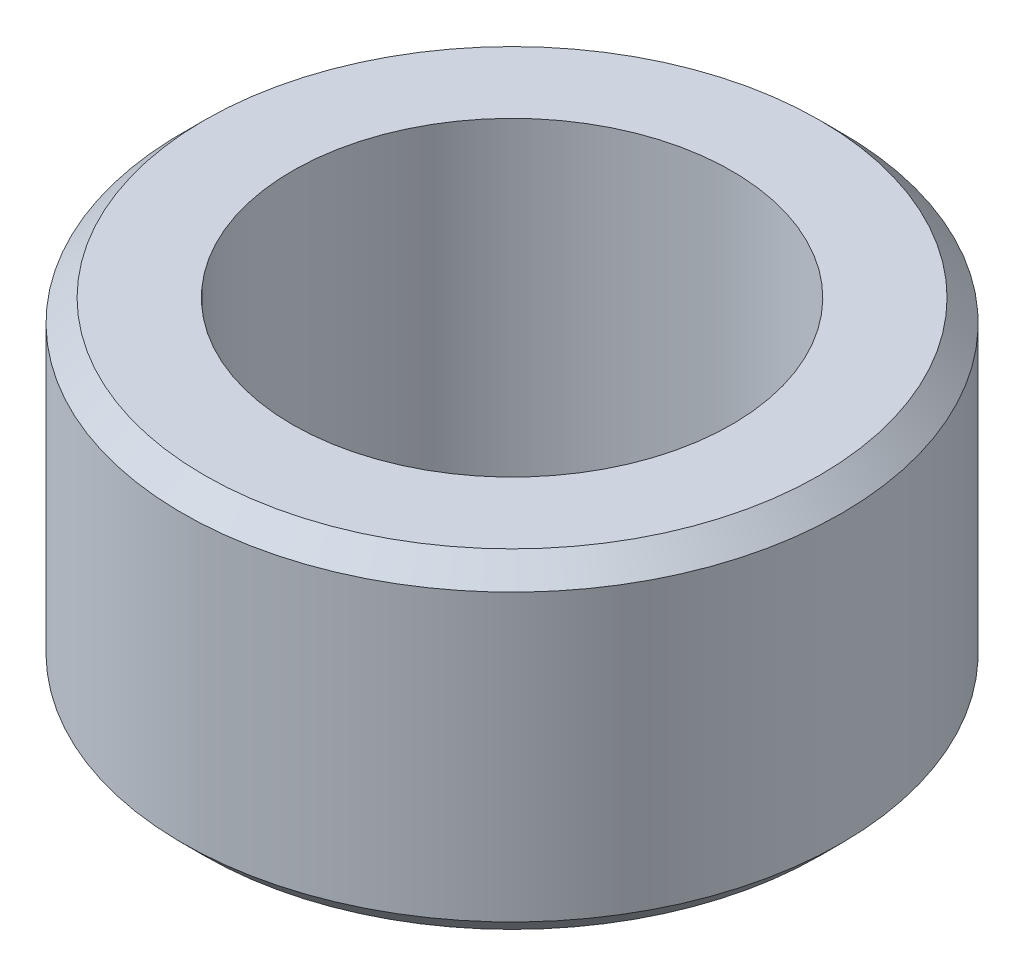
from build123d import *

# Parameters (mm, degrees)
SKETCH_1_R      = 15
SKETCH_1_R_2    = 10
EXTRUDE_1_DEPTH = 15


with BuildPart() as part:
    # 草图1 → 凸台-拉伸1 (new body)
    with BuildSketch(Plane(origin=(0, 0, 0), x_dir=(1, 0, 0), z_dir=(0, 1, 0))):
        with Locations(Location((0, 0, 0), (0, 0, 270))):
            Circle(SKETCH_1_R)
        with Locations(Location((0, 0, 0), (0, 0, 270))):
            Circle(SKETCH_1_R_2, mode=Mode.SUBTRACT)
    extrude(amount=EXTRUDE_1_DEPTH)

    # 草图2 → 切除-旋转1 (revolve, cut)
    with BuildSketch(Plane.XY, mode=Mode.PRIVATE) as cut_revolve_1_sk:
        Polygon((-15, 15), (-14, 15), (-15, 14), align=None)
        Polygon((-15, 0), (-14, 0), (-15, 1), align=None)
    revolve(cut_revolve_1_sk.sketch.rotate(Axis((0, -1000, 0), (0, 1, 0)), 180), axis=Axis((0, -1000, 0), (0, 1, 0)), mode=Mode.SUBTRACT)


solid = part.part
